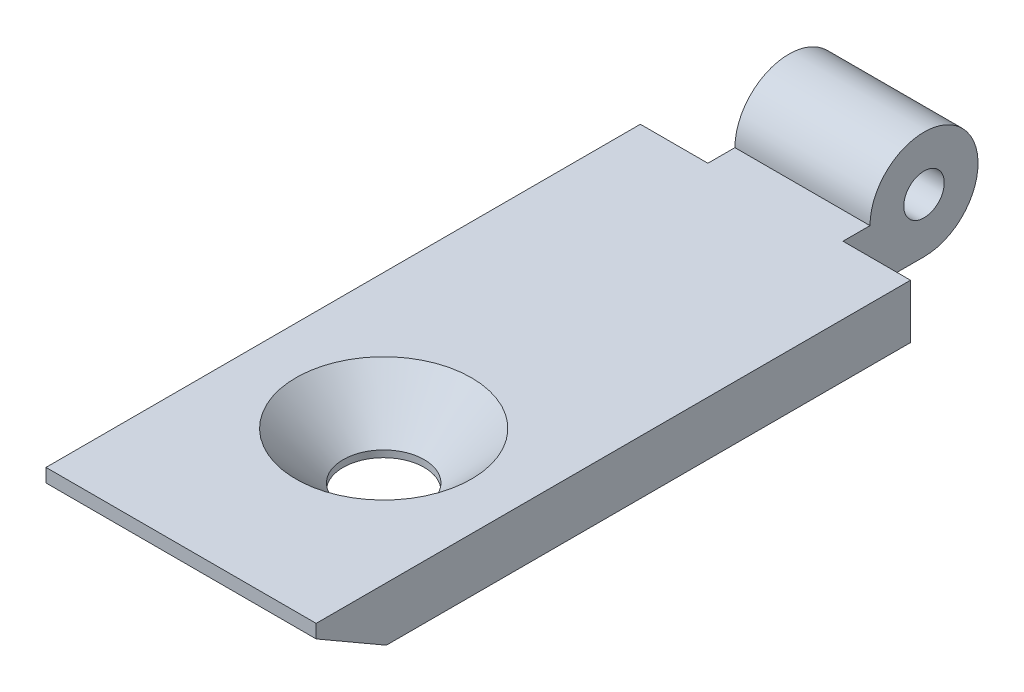
from build123d import *

# Parameters (mm, degrees)
SKETCH_1_R               = 1.5
EXTRUDE_1_DEPTH          = 10
CUT_EXTRUDE_1_DEPTH      = 52.14684741
CUT_EXTRUDE_1_DEPTH_BACK = 52.14684741
SKETCH_3_R               = 3
SKETCH_3_W               = 5
SKETCH_3_H               = 10
CHAMFER_1_SIZE           = 3.5


with BuildPart() as part:
    # 草图1 → 凸台-拉伸1 (new, symmetric)
    with BuildSketch(Plane(origin=(0, 0, 0), x_dir=(0, 0, -1), z_dir=(1, 0, 0))):
        with BuildLine():
            Line((0, -4), (-44.803847577, -4))
            Line((-44.803847577, -4), (-50, -1))
            Line((-50, -1), (-50, 0))
            Line((-50, 0), (-4, 0))
            ThreePointArc((-4, 0), (2.828427125, 2.828427125), (0, -4))
        make_face()
        Circle(SKETCH_1_R, mode=Mode.SUBTRACT)
    extrude(amount=EXTRUDE_1_DEPTH, both=True)

    # 草图3 → 切除-拉伸1 (cut, two sides: drawn at the far end of the back side and taken through both)
    with BuildSketch(Plane(origin=(0, 0, 0), x_dir=(1, 0, 0), z_dir=(0, 1, 0)).offset(-CUT_EXTRUDE_1_DEPTH_BACK)):
        with Locations(Location((0, -35, 0), (0, 0, 270))):
            Circle(SKETCH_3_R)
        with Locations((-7.5, -1)):
            Rectangle(SKETCH_3_W, SKETCH_3_H)
        with Locations((7.5, -1)):
            Rectangle(SKETCH_3_W, SKETCH_3_H)
    extrude(amount=CUT_EXTRUDE_1_DEPTH + CUT_EXTRUDE_1_DEPTH_BACK, mode=Mode.SUBTRACT)

    # 倒角1
    chamfer_1_edges = [part.edges().sort_by_distance(p)[0] for p in [
        (0, 0, 32),
    ]]
    chamfer(chamfer_1_edges, length=CHAMFER_1_SIZE)


solid = part.part
